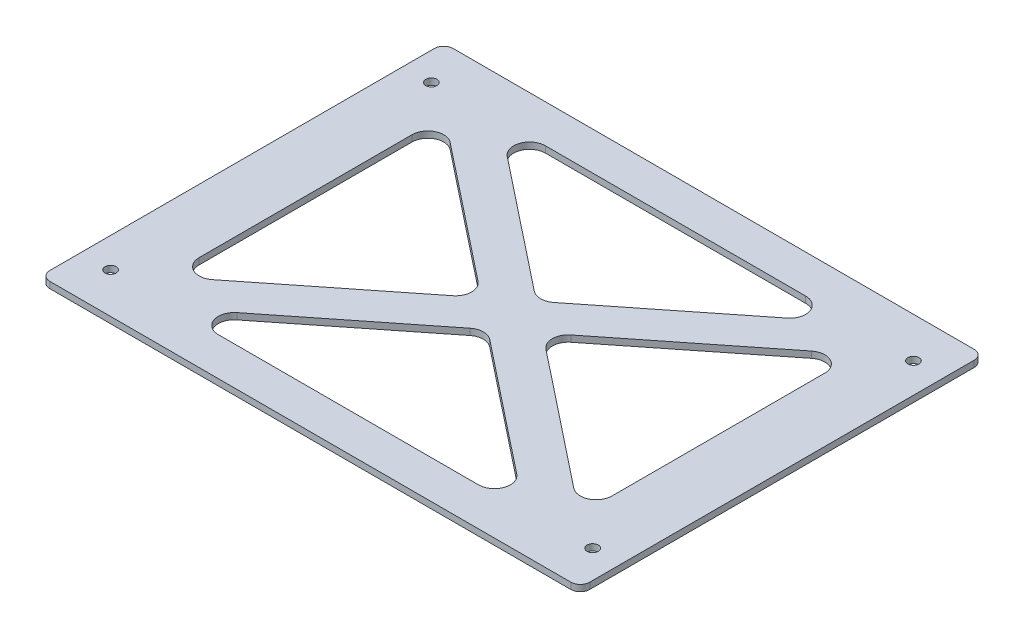
from build123d import *

# Parameters (mm, degrees)
SKETCH1_W           = 170
SKETCH1_H           = 127
BOSS_EXTRUDE1_DEPTH = 2
FILLET1_R           = 5
FILLET2_R           = 3
SKETCH2_R           = 1.75
CUT_EXTRUDE1_DEPTH  = 3
FILLET3_R           = 5


with BuildPart() as part:
    # Sketch1 → Boss-Extrude1 (new body)
    with BuildSketch(Plane(origin=(0, 0, 0), x_dir=(1, 0, 0), z_dir=(0, 1, 0))):
        with Locations((0.791433892, -6.955632319)):
            Rectangle(SKETCH1_W, SKETCH1_H)
        Polygon((-54.546913293, 44.544367681), (56.129781077, 44.544367681), (0.791433892, 0.699369526), align=None, mode=Mode.SUBTRACT)
        Polygon((-64.208566108, 36.889365836), (-64.208566108, -50.800630474), (-8.870218923, -6.955632319), align=None, mode=Mode.SUBTRACT)
        Polygon((-54.546913293, -58.455632319), (56.129781077, -58.455632319), (0.791433892, -14.610634164), align=None, mode=Mode.SUBTRACT)
        Polygon((65.791433892, 36.889365836), (65.791433892, -50.800630474), (10.453086707, -6.955632319), align=None, mode=Mode.SUBTRACT)
    extrude(amount=BOSS_EXTRUDE1_DEPTH)

    # Fillet1
    fillet1_edges = [part.edges().sort_by_distance(p)[0] for p in [
        (0.791433892, 1, -0.699369526),
        (56.129781077, 1, -44.544367681),
        (-54.546913293, 1, -44.544367681),
        (10.453086707, 1, 6.955632319),
        (65.791433892, 1, 50.800630474),
        (65.791433892, 1, -36.889365836),
        (-8.870218923, 1, 6.955632319),
        (-64.208566108, 1, -36.889365836),
        (-64.208566108, 1, 50.800630474),
        (56.129781077, 1, 58.455632319),
        (0.791433892, 1, 14.610634164),
    ]]
    fillet(fillet1_edges, radius=FILLET1_R)

    # Fillet2
    fillet2_edges = [part.edges().sort_by_distance(p)[0] for p in [
        (-84.208566108, 1, -56.544367681),
        (85.791433892, 1, -56.544367681),
        (85.791433892, 1, 70.455632319),
        (-84.208566108, 1, 70.455632319),
    ]]
    fillet(fillet2_edges, radius=FILLET2_R)

    # Sketch2 → Cut-Extrude1 (cut)
    with BuildSketch(Plane(origin=(0, 2, 0), x_dir=(1, 0, 0), z_dir=(0, 1, 0))):
        with Locations(Location((-75.408566108, 43.844367681, 0), (0, 0, 270))):
            Circle(SKETCH2_R)
        with Locations(Location((76.39143389, 43.843581312, 0), (0, 0, 270))):
            Circle(SKETCH2_R)
        with Locations(Location((76.991433894, -57.754647019, 0), (0, 0, 270))):
            Circle(SKETCH2_R)
        with Locations(Location((-74.808566104, -57.75386065, 0), (0, 0, 270))):
            Circle(SKETCH2_R)
    extrude(amount=-CUT_EXTRUDE1_DEPTH, mode=Mode.SUBTRACT)

    # Fillet3
    fillet3_edges = [part.edges().sort_by_distance(p)[0] for p in [
        (-54.546913293, 1, 58.455632319),
    ]]
    fillet(fillet3_edges, radius=FILLET3_R)


solid = part.part
